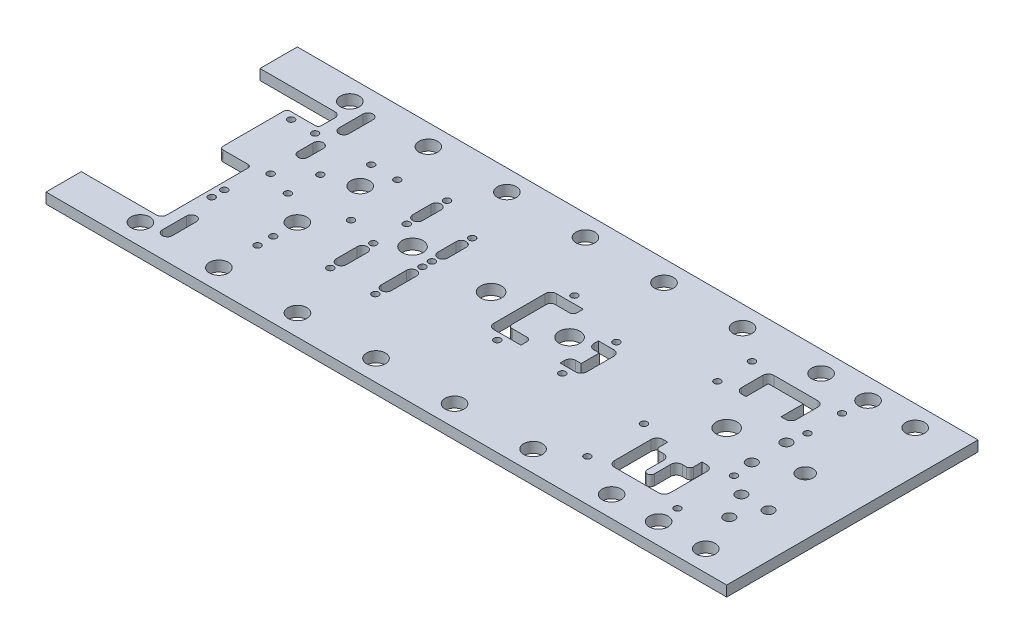
from build123d import *

# Parameters (mm, degrees)
SKETCH1_W                      = 650
SKETCH1_H                      = 240
BOSS_EXTRUDE1_DEPTH            = 10
CUT_EXTRUDE1_REACH             = 348.591
SKETCH2_R                      = 9
SKETCH2_R_2                    = 10
M6_CLEARANCE_HOLE1_D           = 6.4
M6_CLEARANCE_HOLE1_CSINK_D     = 6.45
M6_CLEARANCE_HOLE1_CSINK_ANGLE = 90
CUT_EXTRUDE2_REACH             = 348.591
FILLET1_R                      = 3
CUT_EXTRUDE3_REACH             = 348.591
SKETCH12_R                     = 5.113641914
SKETCH12_R_2                   = 7.613641914
CUT_EXTRUDE4_REACH             = 348.591
CUT_EXTRUDE5_REACH             = 348.591
CUT_EXTRUDE6_REACH             = 348.591


with BuildPart() as part:
    # Sketch1 → Boss-Extrude1 (new body)
    with BuildSketch(Plane(origin=(0, 0, 0), x_dir=(1, 0, 0), z_dir=(0, 1, 0))):
        Rectangle(SKETCH1_W, SKETCH1_H)
    extrude(amount=-BOSS_EXTRUDE1_DEPTH)

    # Sketch2 → Cut-Extrude1 (cut, up to next)
    with BuildSketch(Plane.XZ.offset(10), mode=Mode.PRIVATE) as cut_extrude1_sk1:
        with Locations(Location((-254.87, -100, 0), (0, 0, 270))):
            Circle(SKETCH2_R)
    cut_extrude1_tool1 = extrude(cut_extrude1_sk1.sketch, amount=-CUT_EXTRUDE1_REACH, mode=Mode.PRIVATE) & part.part
    # Sketch2 → Cut-Extrude1 (cut, up to next)
    with BuildSketch(Plane.XZ.offset(10), mode=Mode.PRIVATE) as cut_extrude1_sk2:
        with Locations(Location((285, -100, 0), (0, 0, 270))):
            Circle(SKETCH2_R)
    cut_extrude1_tool2 = extrude(cut_extrude1_sk2.sketch, amount=-CUT_EXTRUDE1_REACH, mode=Mode.PRIVATE) & part.part
    # Sketch2 → Cut-Extrude1 (cut, up to next)
    with BuildSketch(Plane.XZ.offset(10), mode=Mode.PRIVATE) as cut_extrude1_sk3:
        with Locations(Location((120.13, 100, 0), (0, 0, 270))):
            Circle(SKETCH2_R)
    cut_extrude1_tool3 = extrude(cut_extrude1_sk3.sketch, amount=-CUT_EXTRUDE1_REACH, mode=Mode.PRIVATE) & part.part
    # Sketch2 → Cut-Extrude1 (cut, up to next)
    with BuildSketch(Plane.XZ.offset(10), mode=Mode.PRIVATE) as cut_extrude1_sk4:
        with Locations(Location((120.13, -100, 0), (0, 0, 270))):
            Circle(SKETCH2_R)
    cut_extrude1_tool4 = extrude(cut_extrude1_sk4.sketch, amount=-CUT_EXTRUDE1_REACH, mode=Mode.PRIVATE) & part.part
    # Sketch2 → Cut-Extrude1 (cut, up to next)
    with BuildSketch(Plane.XZ.offset(10), mode=Mode.PRIVATE) as cut_extrude1_sk5:
        with Locations(Location((45.13, 100, 0), (0, 0, 270))):
            Circle(SKETCH2_R)
    cut_extrude1_tool5 = extrude(cut_extrude1_sk5.sketch, amount=-CUT_EXTRUDE1_REACH, mode=Mode.PRIVATE) & part.part
    # Sketch2 → Cut-Extrude1 (cut, up to next)
    with BuildSketch(Plane.XZ.offset(10), mode=Mode.PRIVATE) as cut_extrude1_sk6:
        with Locations(Location((240, 100, 0), (0, 0, 270))):
            Circle(SKETCH2_R)
    cut_extrude1_tool6 = extrude(cut_extrude1_sk6.sketch, amount=-CUT_EXTRUDE1_REACH, mode=Mode.PRIVATE) & part.part
    # Sketch2 → Cut-Extrude1 (cut, up to next)
    with BuildSketch(Plane.XZ.offset(10), mode=Mode.PRIVATE) as cut_extrude1_sk7:
        with Locations(Location((240, -100, 0), (0, 0, 270))):
            Circle(SKETCH2_R)
    cut_extrude1_tool7 = extrude(cut_extrude1_sk7.sketch, amount=-CUT_EXTRUDE1_REACH, mode=Mode.PRIVATE) & part.part
    # Sketch2 → Cut-Extrude1 (cut, up to next)
    with BuildSketch(Plane.XZ.offset(10), mode=Mode.PRIVATE) as cut_extrude1_sk8:
        with Locations(Location((195.13, -100, 0), (0, 0, 270))):
            Circle(SKETCH2_R)
    cut_extrude1_tool8 = extrude(cut_extrude1_sk8.sketch, amount=-CUT_EXTRUDE1_REACH, mode=Mode.PRIVATE) & part.part
    # Sketch2 → Cut-Extrude1 (cut, up to next)
    with BuildSketch(Plane.XZ.offset(10), mode=Mode.PRIVATE) as cut_extrude1_sk9:
        with Locations(Location((285, 100, 0), (0, 0, 270))):
            Circle(SKETCH2_R)
    cut_extrude1_tool9 = extrude(cut_extrude1_sk9.sketch, amount=-CUT_EXTRUDE1_REACH, mode=Mode.PRIVATE) & part.part
    # Sketch2 → Cut-Extrude1 (cut, up to next)
    with BuildSketch(Plane.XZ.offset(10), mode=Mode.PRIVATE) as cut_extrude1_sk10:
        with Locations(Location((-104.87, -100, 0), (0, 0, 270))):
            Circle(SKETCH2_R)
    cut_extrude1_tool10 = extrude(cut_extrude1_sk10.sketch, amount=-CUT_EXTRUDE1_REACH, mode=Mode.PRIVATE) & part.part
    # Sketch2 → Cut-Extrude1 (cut, up to next)
    with BuildSketch(Plane.XZ.offset(10), mode=Mode.PRIVATE) as cut_extrude1_sk11:
        with Locations(Location((-179.87, 100, 0), (0, 0, 270))):
            Circle(SKETCH2_R)
    cut_extrude1_tool11 = extrude(cut_extrude1_sk11.sketch, amount=-CUT_EXTRUDE1_REACH, mode=Mode.PRIVATE) & part.part
    # Sketch2 → Cut-Extrude1 (cut, up to next)
    with BuildSketch(Plane.XZ.offset(10), mode=Mode.PRIVATE) as cut_extrude1_sk12:
        with Locations(Location((-179.87, -100, 0), (0, 0, 270))):
            Circle(SKETCH2_R)
    cut_extrude1_tool12 = extrude(cut_extrude1_sk12.sketch, amount=-CUT_EXTRUDE1_REACH, mode=Mode.PRIVATE) & part.part
    # Sketch2 → Cut-Extrude1 (cut, up to next)
    with BuildSketch(Plane.XZ.offset(10), mode=Mode.PRIVATE) as cut_extrude1_sk13:
        with Locations(Location((45.13, -100, 0), (0, 0, 270))):
            Circle(SKETCH2_R)
    cut_extrude1_tool13 = extrude(cut_extrude1_sk13.sketch, amount=-CUT_EXTRUDE1_REACH, mode=Mode.PRIVATE) & part.part
    # Sketch2 → Cut-Extrude1 (cut, up to next)
    with BuildSketch(Plane.XZ.offset(10), mode=Mode.PRIVATE) as cut_extrude1_sk14:
        with Locations(Location((-29.87, 100, 0), (0, 0, 270))):
            Circle(SKETCH2_R)
    cut_extrude1_tool14 = extrude(cut_extrude1_sk14.sketch, amount=-CUT_EXTRUDE1_REACH, mode=Mode.PRIVATE) & part.part
    # Sketch2 → Cut-Extrude1 (cut, up to next)
    with BuildSketch(Plane.XZ.offset(10), mode=Mode.PRIVATE) as cut_extrude1_sk15:
        with Locations(Location((-29.87, -100, 0), (0, 0, 270))):
            Circle(SKETCH2_R)
    cut_extrude1_tool15 = extrude(cut_extrude1_sk15.sketch, amount=-CUT_EXTRUDE1_REACH, mode=Mode.PRIVATE) & part.part
    # Sketch2 → Cut-Extrude1 (cut, up to next)
    with BuildSketch(Plane.XZ.offset(10), mode=Mode.PRIVATE) as cut_extrude1_sk16:
        with Locations(Location((-104.87, 100, 0), (0, 0, 270))):
            Circle(SKETCH2_R)
    cut_extrude1_tool16 = extrude(cut_extrude1_sk16.sketch, amount=-CUT_EXTRUDE1_REACH, mode=Mode.PRIVATE) & part.part
    # Sketch2 → Cut-Extrude1 (cut, up to next)
    with BuildSketch(Plane.XZ.offset(10), mode=Mode.PRIVATE) as cut_extrude1_sk17:
        with Locations(Location((195.13, 100, 0), (0, 0, 270))):
            Circle(SKETCH2_R)
    cut_extrude1_tool17 = extrude(cut_extrude1_sk17.sketch, amount=-CUT_EXTRUDE1_REACH, mode=Mode.PRIVATE) & part.part
    # Sketch2 → Cut-Extrude1 (cut, up to next)
    with BuildSketch(Plane.XZ.offset(10), mode=Mode.PRIVATE) as cut_extrude1_sk18:
        with Locations(Location((-254.87, 100, 0), (0, 0, 270))):
            Circle(SKETCH2_R)
    cut_extrude1_tool18 = extrude(cut_extrude1_sk18.sketch, amount=-CUT_EXTRUDE1_REACH, mode=Mode.PRIVATE) & part.part
    # Sketch2 → Cut-Extrude1 (cut, up to next)
    with BuildSketch(Plane.XZ.offset(10), mode=Mode.PRIVATE) as cut_extrude1_sk19:
        with Locations(Location((195.13, -9.86, 0), (0, 0, 270))):
            Circle(SKETCH2_R_2)
    cut_extrude1_tool19 = extrude(cut_extrude1_sk19.sketch, amount=-CUT_EXTRUDE1_REACH, mode=Mode.PRIVATE) & part.part
    # Sketch2 → Cut-Extrude1 (cut, up to next)
    with BuildSketch(Plane.XZ.offset(10), mode=Mode.PRIVATE) as cut_extrude1_sk20:
        with Locations(Location((45.13, -9.86, 0), (0, 0, 270))):
            Circle(SKETCH2_R_2)
    cut_extrude1_tool20 = extrude(cut_extrude1_sk20.sketch, amount=-CUT_EXTRUDE1_REACH, mode=Mode.PRIVATE) & part.part
    # Sketch2 → Cut-Extrude1 (cut, up to next)
    with BuildSketch(Plane.XZ.offset(10), mode=Mode.PRIVATE) as cut_extrude1_sk21:
        with Locations(Location((-29.87, -9.86, 0), (0, 0, 270))):
            Circle(SKETCH2_R_2)
    cut_extrude1_tool21 = extrude(cut_extrude1_sk21.sketch, amount=-CUT_EXTRUDE1_REACH, mode=Mode.PRIVATE) & part.part
    # Sketch2 → Cut-Extrude1 (cut, up to next)
    with BuildSketch(Plane.XZ.offset(10), mode=Mode.PRIVATE) as cut_extrude1_sk22:
        with Locations(Location((-104.87, -9.86, 0), (0, 0, 270))):
            Circle(SKETCH2_R_2)
    cut_extrude1_tool22 = extrude(cut_extrude1_sk22.sketch, amount=-CUT_EXTRUDE1_REACH, mode=Mode.PRIVATE) & part.part
    # Sketch2 → Cut-Extrude1 (cut, up to next)
    with BuildSketch(Plane.XZ.offset(10), mode=Mode.PRIVATE) as cut_extrude1_sk23:
        with Locations(Location((-179.87, 25.14, 0), (0, 0, 270))):
            Circle(SKETCH2_R)
    cut_extrude1_tool23 = extrude(cut_extrude1_sk23.sketch, amount=-CUT_EXTRUDE1_REACH, mode=Mode.PRIVATE) & part.part
    # Sketch2 → Cut-Extrude1 (cut, up to next)
    with BuildSketch(Plane.XZ.offset(10), mode=Mode.PRIVATE) as cut_extrude1_sk24:
        with Locations(Location((-179.87, -34.86, 0), (0, 0, 270))):
            Circle(SKETCH2_R)
    cut_extrude1_tool24 = extrude(cut_extrude1_sk24.sketch, amount=-CUT_EXTRUDE1_REACH, mode=Mode.PRIVATE) & part.part
    add(cut_extrude1_tool1.solids().sort_by_distance((-254.87, -10, -100))[0], mode=Mode.SUBTRACT)
    add(cut_extrude1_tool2.solids().sort_by_distance((285, -10, -100))[0], mode=Mode.SUBTRACT)
    add(cut_extrude1_tool3.solids().sort_by_distance((120.13, -10, 100))[0], mode=Mode.SUBTRACT)
    add(cut_extrude1_tool4.solids().sort_by_distance((120.13, -10, -100))[0], mode=Mode.SUBTRACT)
    add(cut_extrude1_tool5.solids().sort_by_distance((45.13, -10, 100))[0], mode=Mode.SUBTRACT)
    add(cut_extrude1_tool6.solids().sort_by_distance((240, -10, 100))[0], mode=Mode.SUBTRACT)
    add(cut_extrude1_tool7.solids().sort_by_distance((240, -10, -100))[0], mode=Mode.SUBTRACT)
    add(cut_extrude1_tool8.solids().sort_by_distance((195.13, -10, -100))[0], mode=Mode.SUBTRACT)
    add(cut_extrude1_tool9.solids().sort_by_distance((285, -10, 100))[0], mode=Mode.SUBTRACT)
    add(cut_extrude1_tool10.solids().sort_by_distance((-104.87, -10, -100))[0], mode=Mode.SUBTRACT)
    add(cut_extrude1_tool11.solids().sort_by_distance((-179.87, -10, 100))[0], mode=Mode.SUBTRACT)
    add(cut_extrude1_tool12.solids().sort_by_distance((-179.87, -10, -100))[0], mode=Mode.SUBTRACT)
    add(cut_extrude1_tool13.solids().sort_by_distance((45.13, -10, -100))[0], mode=Mode.SUBTRACT)
    add(cut_extrude1_tool14.solids().sort_by_distance((-29.87, -10, 100))[0], mode=Mode.SUBTRACT)
    add(cut_extrude1_tool15.solids().sort_by_distance((-29.87, -10, -100))[0], mode=Mode.SUBTRACT)
    add(cut_extrude1_tool16.solids().sort_by_distance((-104.87, -10, 100))[0], mode=Mode.SUBTRACT)
    add(cut_extrude1_tool17.solids().sort_by_distance((195.13, -10, 100))[0], mode=Mode.SUBTRACT)
    add(cut_extrude1_tool18.solids().sort_by_distance((-254.87, -10, 100))[0], mode=Mode.SUBTRACT)
    add(cut_extrude1_tool19.solids().sort_by_distance((195.13, -10, -9.86))[0], mode=Mode.SUBTRACT)
    add(cut_extrude1_tool20.solids().sort_by_distance((45.13, -10, -9.86))[0], mode=Mode.SUBTRACT)
    add(cut_extrude1_tool21.solids().sort_by_distance((-29.87, -10, -9.86))[0], mode=Mode.SUBTRACT)
    add(cut_extrude1_tool22.solids().sort_by_distance((-104.87, -10, -9.86))[0], mode=Mode.SUBTRACT)
    add(cut_extrude1_tool23.solids().sort_by_distance((-179.87, -10, 25.14))[0], mode=Mode.SUBTRACT)
    add(cut_extrude1_tool24.solids().sort_by_distance((-179.87, -10, -34.86))[0], mode=Mode.SUBTRACT)

    # M6 Clearance Hole1 (through all)
    with Locations(Plane(origin=(0, -10, 0), x_dir=(-1, 0, 0), z_dir=(0, -1, 0))):
        with Locations((-238.13, -26.14), (-152.13, -26.14), (-152.13, -80.14), (-238.13, -80.14), (-238.13, 77), (-152.13, 77), (-152.13, 44), (-238.13, 44), (-71.5, -23.486173195), (-71.5, 28.206173195), (-12.94, -26.986173195), (-12.94, 46.706173195), (83.37, 45.36), (83.37, 6.86), (126.37, 25.86), (126.37, 64.36), (83.37, -2.14), (126.37, -6.14), (126.37, -47.14), (83.37, -47.14), (156.12, 2.36), (208.37, -5.64), (208.37, 25.36), (192.37, 57.86), (167.37, 57.86), (179.87, -48.14), (179.87, -63.14), (241.62, -33.14), (241.62, -45.14), (232.87, 2.36), (267.87, 56.92), (245.000667118, 56.92)):
            CounterSinkHole(M6_CLEARANCE_HOLE1_D / 2, M6_CLEARANCE_HOLE1_CSINK_D / 2, counter_sink_angle=M6_CLEARANCE_HOLE1_CSINK_ANGLE)

    # Sketch8 → Cut-Extrude2 (cut, up to next)
    with BuildSketch(Plane(origin=(0, 0, 0), x_dir=(1, 0, 0), z_dir=(0, 1, 0)), mode=Mode.PRIVATE) as cut_extrude2_sk1:
        with BuildLine():
            Line((-325, -86.262387825), (-253.37, -86.262387825))
            ThreePointArc((-253.37, -86.262387825), (-249.834466094, -84.797921731), (-248.37, -81.262387825))
            Line((-248.37, -81.262387825), (-248.37, -3.64))
            ThreePointArc((-248.37, -3.64), (-249.248679656, -1.518679656), (-251.37, -0.64))
            Line((-251.37, -0.64), (-278.37, -0.64))
            Line((-278.37, -0.64), (-278.37, 63.48))
            Line((-278.37, 63.48), (-248.37, 63.48))
            Line((-248.37, 63.48), (-248.37, 79.36))
            ThreePointArc((-248.37, 79.36), (-249.834466094, 82.895533906), (-253.37, 84.36))
            Line((-253.37, 84.36), (-325, 84.36))
            Line((-325, 84.36), (-325, -86.262387825))
        make_face()
    cut_extrude2_tool1 = extrude(cut_extrude2_sk1.sketch, amount=-CUT_EXTRUDE2_REACH, mode=Mode.PRIVATE) & part.part
    add(cut_extrude2_tool1.solids().sort_by_distance((-290.753811, 0, 6.541566))[0], mode=Mode.SUBTRACT)

    # Fillet1
    fillet1_edges = [part.edges().sort_by_distance(p)[0] for p in [
        (-248.37, -5, -63.48),
        (-278.37, -5, -63.48),
        (-278.37, -5, 0.64),
    ]]
    fillet(fillet1_edges, radius=FILLET1_R)

    # Sketch12 → Cut-Extrude3 (cut, up to next)
    with BuildSketch(Plane.XZ.offset(10), mode=Mode.PRIVATE) as cut_extrude3_sk1:
        with Locations(Location((270.13, 62.64, 0), (0, 0, 270))):
            Circle(SKETCH12_R)
    cut_extrude3_tool1 = extrude(cut_extrude3_sk1.sketch, amount=-CUT_EXTRUDE3_REACH, mode=Mode.PRIVATE) & part.part
    # Sketch12 → Cut-Extrude3 (cut, up to next)
    with BuildSketch(Plane.XZ.offset(10), mode=Mode.PRIVATE) as cut_extrude3_sk2:
        with Locations(Location((283.13, 38.14, 0), (0, 0, 270))):
            Circle(SKETCH12_R)
    cut_extrude3_tool2 = extrude(cut_extrude3_sk2.sketch, amount=-CUT_EXTRUDE3_REACH, mode=Mode.PRIVATE) & part.part
    # Sketch12 → Cut-Extrude3 (cut, up to next)
    with BuildSketch(Plane.XZ.offset(10), mode=Mode.PRIVATE) as cut_extrude3_sk3:
        with Locations(Location((257.13, 38.14, 0), (0, 0, 270))):
            Circle(SKETCH12_R)
    cut_extrude3_tool3 = extrude(cut_extrude3_sk3.sketch, amount=-CUT_EXTRUDE3_REACH, mode=Mode.PRIVATE) & part.part
    # Sketch12 → Cut-Extrude3 (cut, up to next)
    with BuildSketch(Plane.XZ.offset(10), mode=Mode.PRIVATE) as cut_extrude3_sk4:
        with Locations(Location((270.13, -9.86, 0), (0, 0, 270))):
            Circle(SKETCH12_R_2)
    cut_extrude3_tool4 = extrude(cut_extrude3_sk4.sketch, amount=-CUT_EXTRUDE3_REACH, mode=Mode.PRIVATE) & part.part
    # Sketch12 → Cut-Extrude3 (cut, up to next)
    with BuildSketch(Plane.XZ.offset(10), mode=Mode.PRIVATE) as cut_extrude3_sk5:
        with Locations(Location((235.63, -26.36, 0), (0, 0, 270))):
            Circle(SKETCH12_R)
    cut_extrude3_tool5 = extrude(cut_extrude3_sk5.sketch, amount=-CUT_EXTRUDE3_REACH, mode=Mode.PRIVATE) & part.part
    # Sketch12 → Cut-Extrude3 (cut, up to next)
    with BuildSketch(Plane.XZ.offset(10), mode=Mode.PRIVATE) as cut_extrude3_sk6:
        with Locations(Location((235.63, 6.64, 0), (0, 0, 270))):
            Circle(SKETCH12_R)
    cut_extrude3_tool6 = extrude(cut_extrude3_sk6.sketch, amount=-CUT_EXTRUDE3_REACH, mode=Mode.PRIVATE) & part.part
    # Sketch12 → Cut-Extrude3 (cut, up to next)
    with BuildSketch(Plane.XZ.offset(10), mode=Mode.PRIVATE) as cut_extrude3_sk7:
        with BuildLine():
            Line((211.837653611, -45.067653611), (211.837653611, -66.347653611))
            Line((211.837653611, -66.347653611), (178.422346389, -66.347653611))
            Line((178.422346389, -66.347653611), (178.422346389, -45.067653611))
            Line((178.422346389, -45.067653611), (174.13, -45.067653611))
            ThreePointArc((174.13, -45.067653611), (170.38774598, -46.61774598), (168.837653611, -50.36))
            Line((168.837653611, -50.36), (168.837653611, -70.64))
            ThreePointArc((168.837653611, -70.64), (170.38774598, -74.38225402), (174.13, -75.932346389))
            Line((174.13, -75.932346389), (195.13, -75.932346389))
            Line((195.13, -75.932346389), (216.13, -75.932346389))
            ThreePointArc((216.13, -75.932346389), (219.87225402, -74.38225402), (221.422346389, -70.64))
            Line((221.422346389, -70.64), (221.422346389, -50.36))
            ThreePointArc((221.422346389, -50.36), (219.87225402, -46.61774598), (216.13, -45.067653611))
            Line((216.13, -45.067653611), (211.837653611, -45.067653611))
        make_face()
    cut_extrude3_tool7 = extrude(cut_extrude3_sk7.sketch, amount=-CUT_EXTRUDE3_REACH, mode=Mode.PRIVATE) & part.part
    # Sketch12 → Cut-Extrude3 (cut, up to next)
    with BuildSketch(Plane.XZ.offset(10), mode=Mode.PRIVATE) as cut_extrude3_sk8:
        with BuildLine():
            Line((211.516358086, 30.026358086), (216.13, 30.026358086))
            ThreePointArc((216.13, 30.026358086), (220.099444264, 31.670555736), (221.743641914, 35.64))
            Line((221.743641914, 35.64), (221.743641914, 53.14))
            Line((221.743641914, 53.14), (221.743641914, 70.64))
            ThreePointArc((221.743641914, 70.64), (220.099444264, 74.609444264), (216.13, 76.253641914))
            Line((216.13, 76.253641914), (174.13, 76.253641914))
            ThreePointArc((174.13, 76.253641914), (170.160555736, 74.609444264), (168.516358086, 70.64))
            Line((168.516358086, 70.64), (168.516358086, 35.64))
            ThreePointArc((168.516358086, 35.64), (170.160555736, 31.670555736), (174.13, 30.026358086))
            Line((174.13, 30.026358086), (178.743641914, 30.026358086))
            Line((178.743641914, 30.026358086), (178.743641914, 38.14))
            ThreePointArc((178.743641914, 38.14), (179.735483234, 40.534516766), (182.13, 41.526358086))
            Line((182.13, 41.526358086), (186.13, 41.526358086))
            ThreePointArc((186.13, 41.526358086), (190.099444264, 43.170555736), (191.743641914, 47.14))
            Line((191.743641914, 47.14), (191.743641914, 62.64))
            ThreePointArc((191.743641914, 62.64), (195.13, 66.026358086), (198.516358086, 62.64))
            Line((198.516358086, 62.64), (198.516358086, 47.14))
            ThreePointArc((198.516358086, 47.14), (200.160555736, 43.170555736), (204.13, 41.526358086))
            Line((204.13, 41.526358086), (208.13, 41.526358086))
            ThreePointArc((208.13, 41.526358086), (210.524516766, 40.534516766), (211.516358086, 38.14))
            Line((211.516358086, 38.14), (211.516358086, 30.026358086))
        make_face()
    cut_extrude3_tool8 = extrude(cut_extrude3_sk8.sketch, amount=-CUT_EXTRUDE3_REACH, mode=Mode.PRIVATE) & part.part
    add(cut_extrude3_tool1.solids().sort_by_distance((270.13, -10, 62.64))[0], mode=Mode.SUBTRACT)
    add(cut_extrude3_tool2.solids().sort_by_distance((283.13, -10, 38.14))[0], mode=Mode.SUBTRACT)
    add(cut_extrude3_tool3.solids().sort_by_distance((257.13, -10, 38.14))[0], mode=Mode.SUBTRACT)
    add(cut_extrude3_tool4.solids().sort_by_distance((270.13, -10, -9.86))[0], mode=Mode.SUBTRACT)
    add(cut_extrude3_tool5.solids().sort_by_distance((235.63, -10, -26.36))[0], mode=Mode.SUBTRACT)
    add(cut_extrude3_tool6.solids().sort_by_distance((235.63, -10, 6.64))[0], mode=Mode.SUBTRACT)
    add(cut_extrude3_tool7.solids().sort_by_distance((205.63, -10, -75.32261))[0], mode=Mode.SUBTRACT)
    add(cut_extrude3_tool8.solids().sort_by_distance((206.13, -10, 42.231348))[0], mode=Mode.SUBTRACT)

    # Sketch13 → Cut-Extrude4 (cut, up to next)
    with BuildSketch(Plane.XZ.offset(10), mode=Mode.PRIVATE) as cut_extrude4_sk1:
        with BuildLine():
            Line((61.837653611, 15.932346389), (61.837653611, 11.64))
            ThreePointArc((61.837653611, 11.64), (63.38774598, 7.89774598), (67.13, 6.347653611))
            Line((67.13, 6.347653611), (72.337653611, 6.347653611))
            Line((72.337653611, 6.347653611), (72.337653611, -11.067653611))
            Line((72.337653611, -11.067653611), (67.13, -11.067653611))
            ThreePointArc((67.13, -11.067653611), (63.38774598, -12.61774598), (61.837653611, -16.36))
            Line((61.837653611, -16.36), (61.837653611, -20.652346389))
            Line((61.837653611, -20.652346389), (76.63, -20.652346389))
            ThreePointArc((76.63, -20.652346389), (80.37225402, -19.10225402), (81.922346389, -15.36))
            Line((81.922346389, -15.36), (81.922346389, -2.36))
            Line((81.922346389, -2.36), (81.922346389, 10.64))
            ThreePointArc((81.922346389, 10.64), (80.37225402, 14.38225402), (76.63, 15.932346389))
            Line((76.63, 15.932346389), (61.837653611, 15.932346389))
        make_face()
    cut_extrude4_tool1 = extrude(cut_extrude4_sk1.sketch, amount=-CUT_EXTRUDE4_REACH, mode=Mode.PRIVATE) & part.part
    # Sketch13 → Cut-Extrude4 (cut, up to next)
    with BuildSketch(Plane.XZ.offset(10), mode=Mode.PRIVATE) as cut_extrude4_sk2:
        with BuildLine():
            Line((2.63, -39.652346389), (28.422346389, -39.652346389))
            Line((28.422346389, -39.652346389), (28.422346389, -33.86))
            ThreePointArc((28.422346389, -33.86), (27.311593849, -31.178406151), (24.63, -30.067653611))
            Line((24.63, -30.067653611), (10.63, -30.067653611))
            ThreePointArc((10.63, -30.067653611), (8.00829299, -28.98170701), (6.922346389, -26.36))
            Line((6.922346389, -26.36), (6.922346389, 6.64))
            ThreePointArc((6.922346389, 6.64), (8.00829299, 9.26170701), (10.63, 10.347653611))
            Line((10.63, 10.347653611), (24.63, 10.347653611))
            ThreePointArc((24.63, 10.347653611), (27.311593849, 11.458406151), (28.422346389, 14.14))
            Line((28.422346389, 14.14), (28.422346389, 19.932346389))
            Line((28.422346389, 19.932346389), (2.63, 19.932346389))
            ThreePointArc((2.63, 19.932346389), (-1.11225402, 18.38225402), (-2.662346389, 14.64))
            Line((-2.662346389, 14.64), (-2.662346389, -13.23))
            Line((-2.662346389, -13.23), (-2.662346389, -34.36))
            ThreePointArc((-2.662346389, -34.36), (-1.11225402, -38.10225402), (2.63, -39.652346389))
        make_face()
    cut_extrude4_tool2 = extrude(cut_extrude4_sk2.sketch, amount=-CUT_EXTRUDE4_REACH, mode=Mode.PRIVATE) & part.part
    add(cut_extrude4_tool1.solids().sort_by_distance((73.54007, -10, -2.36))[0], mode=Mode.SUBTRACT)
    add(cut_extrude4_tool2.solids().sort_by_distance((-0.637039, -10, -37.627039))[0], mode=Mode.SUBTRACT)

    # Sketch14 → Cut-Extrude5 (cut, up to next)
    with BuildSketch(Plane.XZ.offset(10), mode=Mode.PRIVATE) as cut_extrude5_sk1:
        with BuildLine():
            Line((-88.162346389, -17.31), (-88.162346389, -34.91))
            ThreePointArc((-88.162346389, -34.91), (-83.37, -39.702346389), (-78.577653611, -34.91))
            Line((-78.577653611, -34.91), (-78.577653611, -26.11))
            Line((-78.577653611, -26.11), (-78.577653611, -17.31))
            ThreePointArc((-78.577653611, -17.31), (-83.37, -12.517653611), (-88.162346389, -17.31))
        make_face()
    cut_extrude5_tool1 = extrude(cut_extrude5_sk1.sketch, amount=-CUT_EXTRUDE5_REACH, mode=Mode.PRIVATE) & part.part
    # Sketch14 → Cut-Extrude5 (cut, up to next)
    with BuildSketch(Plane.XZ.offset(10), mode=Mode.PRIVATE) as cut_extrude5_sk2:
        with BuildLine():
            Line((-78.577653611, 12.59), (-78.577653611, 24.64))
            Line((-78.577653611, 24.64), (-78.577653611, 36.69))
            ThreePointArc((-78.577653611, 36.69), (-83.37, 41.482346389), (-88.162346389, 36.69))
            Line((-88.162346389, 36.69), (-88.162346389, 12.59))
            ThreePointArc((-88.162346389, 12.59), (-83.37, 7.797653611), (-78.577653611, 12.59))
        make_face()
    cut_extrude5_tool2 = extrude(cut_extrude5_sk2.sketch, amount=-CUT_EXTRUDE5_REACH, mode=Mode.PRIVATE) & part.part
    # Sketch14 → Cut-Extrude5 (cut, up to next)
    with BuildSketch(Plane.XZ.offset(10), mode=Mode.PRIVATE) as cut_extrude5_sk3:
        with BuildLine():
            Line((-131.232166649, 36.69), (-131.232166649, 16.59))
            ThreePointArc((-131.232166649, 16.59), (-126.37, 11.727833351), (-121.507833351, 16.59))
            Line((-121.507833351, 16.59), (-121.507833351, 26.64))
            Line((-121.507833351, 26.64), (-121.507833351, 36.69))
            ThreePointArc((-121.507833351, 36.69), (-126.37, 41.552166649), (-131.232166649, 36.69))
        make_face()
    cut_extrude5_tool3 = extrude(cut_extrude5_sk3.sketch, amount=-CUT_EXTRUDE5_REACH, mode=Mode.PRIVATE) & part.part
    # Sketch14 → Cut-Extrude5 (cut, up to next)
    with BuildSketch(Plane.XZ.offset(10), mode=Mode.PRIVATE) as cut_extrude5_sk4:
        with BuildLine():
            Line((-131.162346389, -36.31), (-131.162346389, -53.91))
            ThreePointArc((-131.162346389, -53.91), (-126.37, -58.702346389), (-121.577653611, -53.91))
            Line((-121.577653611, -53.91), (-121.577653611, -45.11))
            Line((-121.577653611, -45.11), (-121.577653611, -36.31))
            ThreePointArc((-121.577653611, -36.31), (-126.37, -31.517653611), (-131.162346389, -36.31))
        make_face()
    cut_extrude5_tool4 = extrude(cut_extrude5_sk4.sketch, amount=-CUT_EXTRUDE5_REACH, mode=Mode.PRIVATE) & part.part
    add(cut_extrude5_tool1.solids().sort_by_distance((-83.37, -10, -26.11))[0], mode=Mode.SUBTRACT)
    add(cut_extrude5_tool2.solids().sort_by_distance((-83.37, -10, 24.64))[0], mode=Mode.SUBTRACT)
    add(cut_extrude5_tool3.solids().sort_by_distance((-126.37, -10, 26.64))[0], mode=Mode.SUBTRACT)
    add(cut_extrude5_tool4.solids().sort_by_distance((-126.37, -10, -45.11))[0], mode=Mode.SUBTRACT)

    # Sketch15 → Cut-Extrude6 (cut, up to next)
    with BuildSketch(Plane.XZ.offset(10), mode=Mode.PRIVATE) as cut_extrude6_sk1:
        with BuildLine():
            Line((-228.577653611, -95.77), (-228.577653611, -84.32))
            Line((-228.577653611, -84.32), (-228.577653611, -72.87))
            ThreePointArc((-228.577653611, -72.87), (-233.37, -68.077653611), (-238.162346389, -72.87))
            Line((-238.162346389, -72.87), (-238.162346389, -95.77))
            ThreePointArc((-238.162346389, -95.77), (-233.37, -100.562346389), (-228.577653611, -95.77))
        make_face()
    cut_extrude6_tool1 = extrude(cut_extrude6_sk1.sketch, amount=-CUT_EXTRUDE6_REACH, mode=Mode.PRIVATE) & part.part
    # Sketch15 → Cut-Extrude6 (cut, up to next)
    with BuildSketch(Plane.XZ.offset(10), mode=Mode.PRIVATE) as cut_extrude6_sk2:
        with BuildLine():
            Line((-238.162346389, -33.86), (-238.162346389, -48.36))
            ThreePointArc((-238.162346389, -48.36), (-233.37, -53.152346389), (-228.577653611, -48.36))
            Line((-228.577653611, -48.36), (-228.577653611, -41.11))
            Line((-228.577653611, -41.11), (-228.577653611, -33.86))
            ThreePointArc((-228.577653611, -33.86), (-233.37, -29.067653611), (-238.162346389, -33.86))
        make_face()
    cut_extrude6_tool2 = extrude(cut_extrude6_sk2.sketch, amount=-CUT_EXTRUDE6_REACH, mode=Mode.PRIVATE) & part.part
    # Sketch15 → Cut-Extrude6 (cut, up to next)
    with BuildSketch(Plane.XZ.offset(10), mode=Mode.PRIVATE) as cut_extrude6_sk3:
        with BuildLine():
            Line((-238.162346389, 95.77), (-238.162346389, 72.87))
            ThreePointArc((-238.162346389, 72.87), (-233.37, 68.077653611), (-228.577653611, 72.87))
            Line((-228.577653611, 72.87), (-228.577653611, 84.32))
            Line((-228.577653611, 84.32), (-228.577653611, 95.77))
            ThreePointArc((-228.577653611, 95.77), (-233.37, 100.562346389), (-238.162346389, 95.77))
        make_face()
    cut_extrude6_tool3 = extrude(cut_extrude6_sk3.sketch, amount=-CUT_EXTRUDE6_REACH, mode=Mode.PRIVATE) & part.part
    add(cut_extrude6_tool1.solids().sort_by_distance((-233.37, -10, -84.32))[0], mode=Mode.SUBTRACT)
    add(cut_extrude6_tool2.solids().sort_by_distance((-233.37, -10, -41.11))[0], mode=Mode.SUBTRACT)
    add(cut_extrude6_tool3.solids().sort_by_distance((-233.37, -10, 84.32))[0], mode=Mode.SUBTRACT)


solid = part.part
